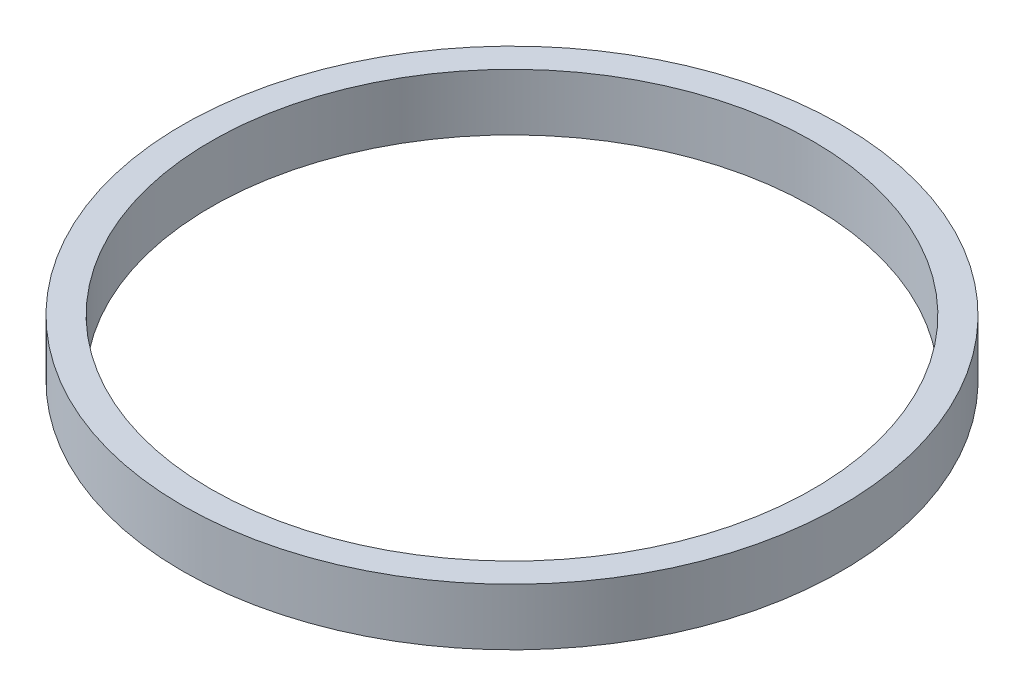
from build123d import *

# Parameters (mm, degrees)
SKETCH1_R           = 29
SKETCH1_R_2         = 26.5
BOSS_EXTRUDE1_DEPTH = 5


with BuildPart() as part:
    # Sketch1 → Boss-Extrude1 (new body)
    with BuildSketch(Plane(origin=(0, 0, 0), x_dir=(1, 0, 0), z_dir=(0, 1, 0))):
        Circle(SKETCH1_R)
        Circle(SKETCH1_R_2, mode=Mode.SUBTRACT)
    extrude(amount=BOSS_EXTRUDE1_DEPTH)


solid = part.part
